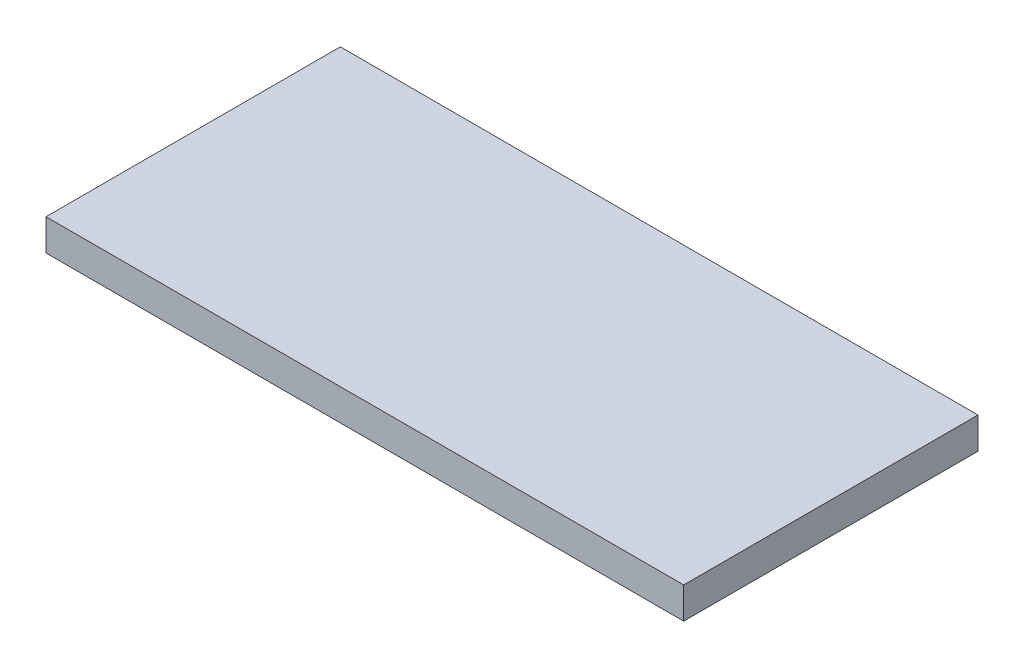
from build123d import *

# Parameters (mm, degrees)
SKETCH1_W           = 65
SKETCH1_H           = 30
BOSS_EXTRUDE1_DEPTH = 3.2


with BuildPart() as part:
    # Sketch1 → Boss-Extrude1 (new body)
    with BuildSketch(Plane(origin=(0, 0, 0), x_dir=(1, 0, 0), z_dir=(0, 1, 0))):
        with Locations((32.5, 15)):
            Rectangle(SKETCH1_W, SKETCH1_H)
    extrude(amount=BOSS_EXTRUDE1_DEPTH)


solid = part.part
